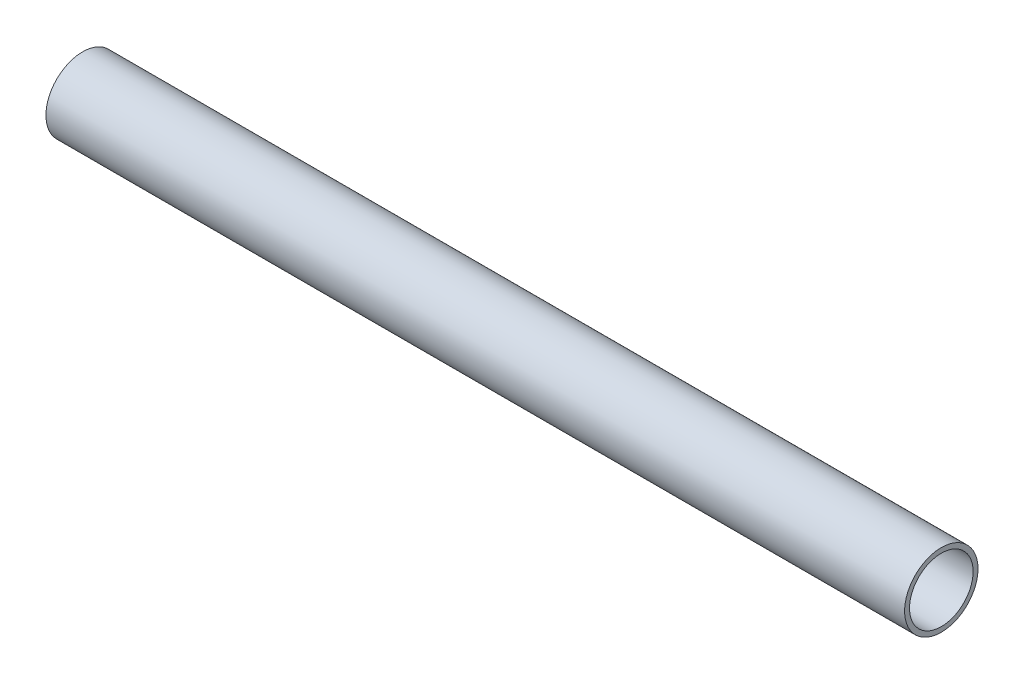
from build123d import *

# Parameters (mm, degrees)
SKETCH_1_R      = 7.5
SKETCH_1_R_2    = 6.5
EXTRUDE_1_DEPTH = 175.5


with BuildPart() as part:
    # 草图1 → 凸台-拉伸1 (new body)
    with BuildSketch(Plane(origin=(0, 0, 0), x_dir=(0, 0, -1), z_dir=(1, 0, 0))):
        Circle(SKETCH_1_R)
        Circle(SKETCH_1_R_2, mode=Mode.SUBTRACT)
    extrude(amount=EXTRUDE_1_DEPTH)


solid = part.part
